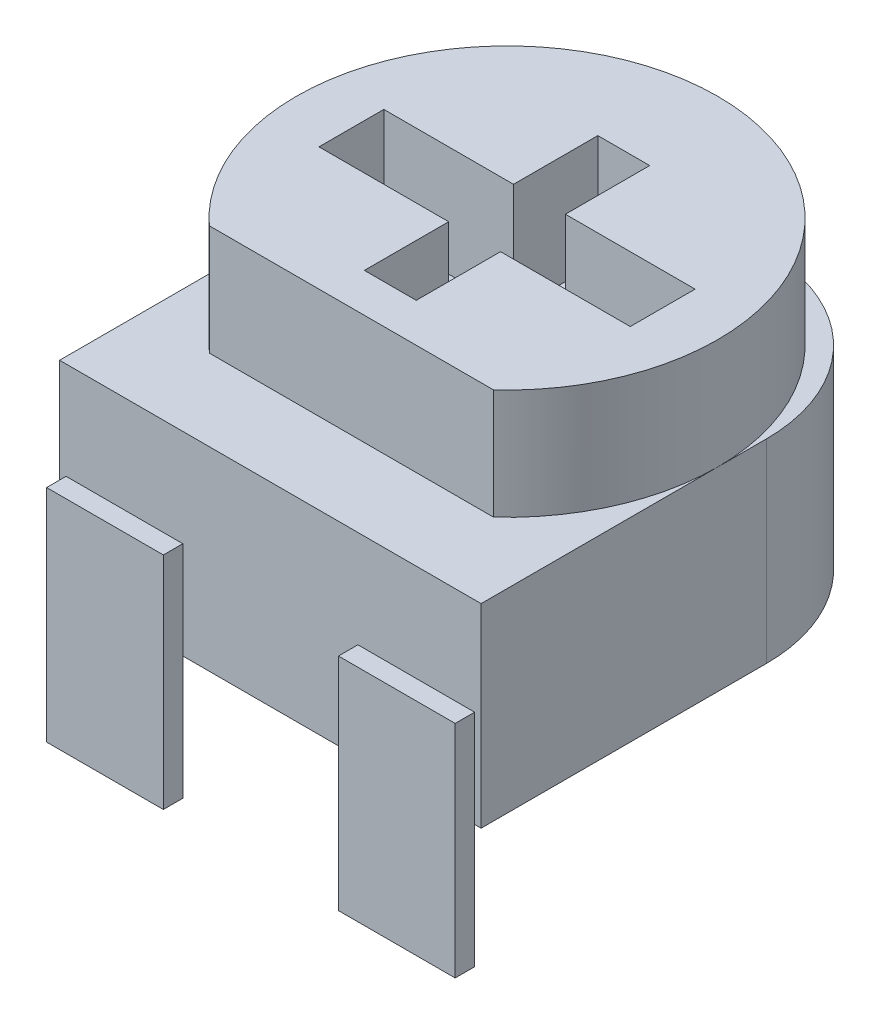
from build123d import *

# Parameters (mm, degrees)
SKETCH_1_W          = 6.5
SKETCH_1_H          = 6.9
EXTRUDE_1_DEPTH     = 3
EXTRUDE_START       = 3
SKETCH_1_3_R        = 3.25
EXTRUDE_2_DEPTH     = 1.7
CUT_EXTRUDE_START   = 3
CUT_EXTRUDE_1_DEPTH = 1.7
FILLET_1_R          = 2.5
SKETCH_2_W          = 1.8
SKETCH_2_H          = 3.4
EXTRUDE_3_DEPTH     = 0.3
SKETCH_3_W          = 2.3
SKETCH_3_H          = 0.3
EXTRUDE_4_DEPTH     = 1.9


with BuildPart() as part:
    # 草图1 → 凸台-拉伸1 (new body)
    with BuildSketch(Plane(origin=(0, 0, 0), x_dir=(1, 0, 0), z_dir=(0, 1, 0))):
        with Locations((0, -0.2)):
            Rectangle(SKETCH_1_W, SKETCH_1_H)
    extrude(amount=EXTRUDE_1_DEPTH)

    # 草图1<3> → 凸台-拉伸2 (add)
    with BuildSketch(Plane(origin=(0, 0, 0), x_dir=(1, 0, 0), z_dir=(0, 1, 0)).offset(EXTRUDE_START)):
        with Locations(Location((0, 0, 0), (0, 0, 90))):
            Circle(SKETCH_1_3_R)
        Polygon((-2.4, -0.5), (-2.4, 0.5), (-0.4, 0.5), (-0.4, 1.8), (0.4, 1.8), (0.4, 0.5), (2.4, 0.5), (2.4, -0.5), (0.4, -0.5), (0.4, -1.8), (-0.4, -1.8), (-0.4, -0.5), align=None, mode=Mode.SUBTRACT)
    extrude(amount=EXTRUDE_2_DEPTH)

    # 草图1<4> → 切除-拉伸1 (cut)
    with BuildSketch(Plane(origin=(0, 0, 0), x_dir=(1, 0, 0), z_dir=(0, 1, 0)).offset(CUT_EXTRUDE_START)):
        with BuildLine():
            Line((2.1914607, -2.4), (-2.1914607, -2.4))
            ThreePointArc((-2.1914607, -2.4), (0, -3.25), (2.1914607, -2.4))
        make_face()
    extrude(amount=CUT_EXTRUDE_1_DEPTH, mode=Mode.SUBTRACT)

    # 圆角1
    fillet_1_edges = [part.edges().sort_by_distance(p)[0] for p in [
        (-3.25, 1.5, -3.25),
        (3.25, 1.5, -3.25),
    ]]
    fillet(fillet_1_edges, radius=FILLET_1_R)

    # 草图2 → 凸台-拉伸3 (add)
    with BuildSketch(Plane.XY.offset(3.65)):
        with Locations((-2.25, -0.2)):
            Rectangle(SKETCH_2_W, SKETCH_2_H)
        with Locations((2.25, -0.2)):
            Rectangle(SKETCH_2_W, SKETCH_2_H)
    extrude(amount=EXTRUDE_3_DEPTH)

    # 草图3 → 凸台-拉伸4 (add)
    with BuildSketch(Plane.XZ):
        with Locations((0, -2.4)):
            Rectangle(SKETCH_3_W, SKETCH_3_H)
    extrude(amount=EXTRUDE_4_DEPTH)


solid = part.part
